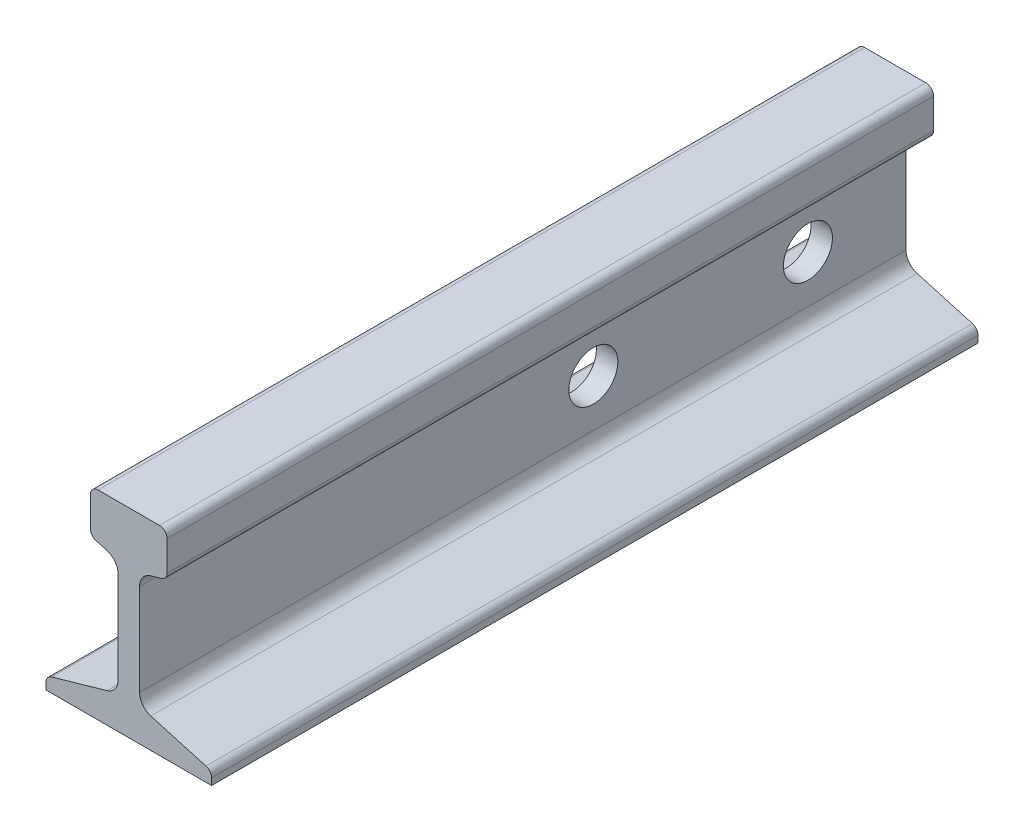
from build123d import *

# Parameters (mm, degrees)
EXTRUDE_1_DEPTH     = 250
SKETCH_7_R          = 8
CUT_EXTRUDE_2_DEPTH = 40


with BuildPart() as part:
    # 草图1 → 凸台-拉伸1 (new body)
    with BuildSketch(Plane.XY):
        with BuildLine():
            Line((0, 0), (54, 0))
            Line((54, 0), (54, 2.192931695))
            ThreePointArc((54, 2.192931695), (53.49587162, 3.698420478), (52.18680282, 4.596741564))
            Line((52.18680282, 4.596741564), (34.153085808, 9.749232139))
            ThreePointArc((34.153085808, 9.749232139), (31.534948207, 11.545874311), (30.526691448, 14.556851877))
            Line((30.526691448, 14.556851877), (30.526691448, 44.523721966))
            ThreePointArc((30.526691448, 44.523721966), (31.534948207, 47.534699532), (34.153085808, 49.331341705))
            Line((34.153085808, 49.331341705), (37.68680282, 50.340975136))
            ThreePointArc((37.68680282, 50.340975136), (38.99587162, 51.239296223), (39.5, 52.744785005))
            Line((39.5, 52.744785005), (39.5, 62.5))
            ThreePointArc((39.5, 62.5), (38.767766953, 64.267766953), (37, 65))
            Line((37, 65), (17, 65))
            ThreePointArc((17, 65), (15.232233047, 64.267766953), (14.5, 62.5))
            Line((14.5, 62.5), (14.5, 52.744785005))
            ThreePointArc((14.5, 52.744785005), (15.00412838, 51.239296223), (16.31319718, 50.340975136))
            Line((16.31319718, 50.340975136), (19.900297087, 49.316089449))
            ThreePointArc((19.900297087, 49.316089449), (22.518434689, 47.519447276), (23.526691448, 44.50846971))
            Line((23.526691448, 44.50846971), (23.526691448, 14.572104133))
            ThreePointArc((23.526691448, 14.572104133), (22.518434689, 11.561126567), (19.900297087, 9.764484395))
            Line((19.900297087, 9.764484395), (1.81319718, 4.596741564))
            ThreePointArc((1.81319718, 4.596741564), (0.50412838, 3.698420478), (0, 2.192931695))
            Line((0, 2.192931695), (0, 0))
        make_face()
    extrude(amount=EXTRUDE_1_DEPTH)

    # 草图7 → 切除-拉伸2 (cut)
    with BuildSketch(Plane(origin=(0, 0, 0), x_dir=(0, 0, -1), z_dir=(1, 0, 0))):
        with Locations(Location((-32, 30, 0), (0, 0, 90))):
            Circle(SKETCH_7_R)
        with Locations(Location((-102, 30, 0), (0, 0, 90))):
            Circle(SKETCH_7_R)
    extrude(amount=CUT_EXTRUDE_2_DEPTH, mode=Mode.SUBTRACT)


solid = part.part
